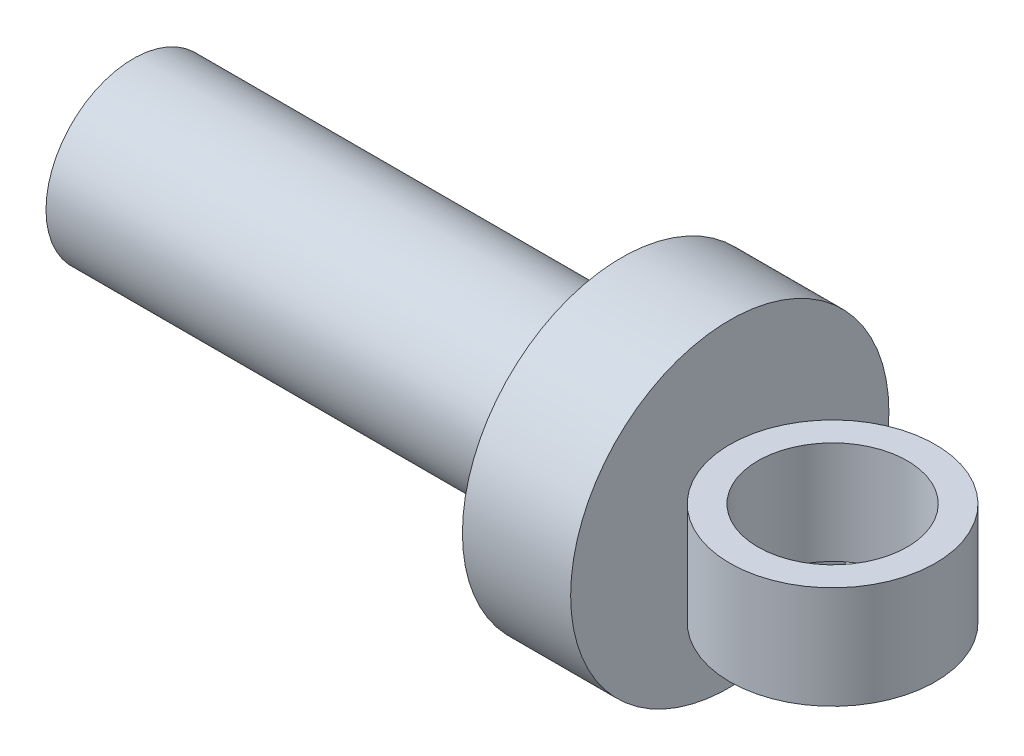
from build123d import *

# Parameters (mm, degrees)
SKETCH2_R           = 20.03
SKETCH2_R_2         = 14.555
BOSS_EXTRUDE1_DEPTH = 10


with BuildPart() as part:
    # Sketch1 → Revolve1 (revolve)
    with BuildSketch(Plane.XY, mode=Mode.PRIVATE) as revolve1_sk:
        Polygon((-116.2, 12), (-5, 12), (-5, 0), (0, 0), (0, 15), (0, 31), (-21.080384326, 31), (-21.080384326, 30), (-1, 30), (-1, 17), (-116.2, 17), align=None)
    revolve(revolve1_sk.sketch.rotate(Axis((-5, 0, 0), (1, 0, 0)), 90), axis=Axis((-5, 0, 0), (1, 0, 0)))


with BuildPart() as body_2:
    # Sketch2 → Boss-Extrude1 (new, symmetric)
    with BuildSketch(Plane(origin=(0, 0, 0), x_dir=(1, 0, 0), z_dir=(0, 1, 0))):
        with Locations(Location((20.03, 0, 0), (0, 0, 270))):
            Circle(SKETCH2_R)
        with Locations(Location((20.03, 0, 0), (0, 0, 270))):
            Circle(SKETCH2_R_2, mode=Mode.SUBTRACT)
    extrude(amount=BOSS_EXTRUDE1_DEPTH, both=True)


solid = Compound([part.part, body_2.part])
